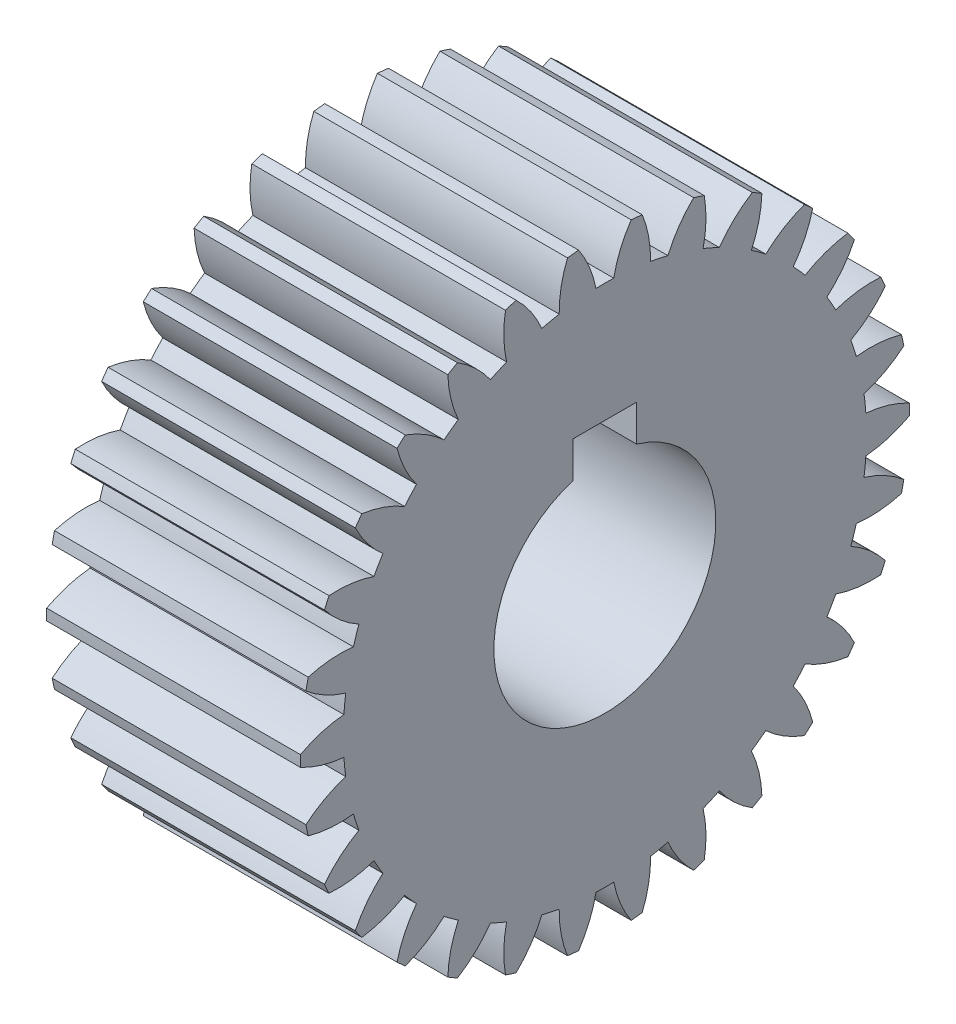
from build123d import *

# Parameters (mm, degrees)
BASPROSKE_W     = 8
BASPROSKE_H     = 9.6
TOOTHCUT_DEPTH  = 16.758172483
TEETHCUTS_COUNT = 30
TEETHCUTS_ANGLE = 348
BORSKE_R        = 3.5
BORE_DEPTH      = 50.0000508
KEYSKE_W        = 2
KEYSKE_H        = 4.5
KEYWAY_DEPTH    = 50.0000508


with BuildPart() as part:
    # BasProSke → Base-Revolve (revolve)
    with BuildSketch(Plane(origin=(0, 0, 0), x_dir=(1, 0, 0), z_dir=(0, 1, 0)), mode=Mode.PRIVATE) as base_revolve_sk:
        with Locations((4, 4.8)):
            Rectangle(BASPROSKE_W, BASPROSKE_H)
    revolve(base_revolve_sk.sketch.rotate(Axis((-10, 0, 0), (1, 0, 0)), 180), axis=Axis((-10, 0, 0), (1, 0, 0)))

    # TooCutSke → ToothCut (cut, through all)
    with BuildSketch(Plane(origin=(0, 0, 0), x_dir=(0, 0, -1), z_dir=(1, 0, 0))):
        with BuildLine():
            ThreePointArc((0.280083172, 8.244243714), (0, 8.249), (-0.280083172, 8.244243714))
            ThreePointArc((-0.280083172, 8.244243714), (-0.494011324, 8.945142616), (-0.845441941, 9.588198636))
            ThreePointArc((-0.845441941, 9.588198636), (0, 9.6254), (0.845441941, 9.588198636))
            ThreePointArc((0.845441941, 9.588198636), (0.494011324, 8.945142616), (0.280083172, 8.244243714))
        make_face()
    toothcut = extrude(amount=TOOTHCUT_DEPTH, mode=Mode.SUBTRACT)

    # TeethCuts: ToothCut ×30 about axis
    teethcuts_axis = Axis((-10, 0, 0), (1, 0, 0))
    for i in range(1, TEETHCUTS_COUNT):
        add(toothcut.rotate(teethcuts_axis, i * TEETHCUTS_ANGLE / (TEETHCUTS_COUNT - 1)), mode=Mode.SUBTRACT)

    # BorSke → Bore (cut, symmetric)
    with BuildSketch(Plane(origin=(0, 0, 0), x_dir=(0, 0, -1), z_dir=(1, 0, 0))):
        with Locations(Location((0, 0, 0), (0, 0, 180))):
            Circle(BORSKE_R)
    extrude(amount=BORE_DEPTH, both=True, mode=Mode.SUBTRACT)

    # KeySke → Keyway (cut, symmetric)
    with BuildSketch(Plane(origin=(0, 0, 0), x_dir=(0, 0, -1), z_dir=(1, 0, 0))):
        with Locations((0, 2.25)):
            Rectangle(KEYSKE_W, KEYSKE_H)
    extrude(amount=KEYWAY_DEPTH, both=True, mode=Mode.SUBTRACT)


solid = part.part
